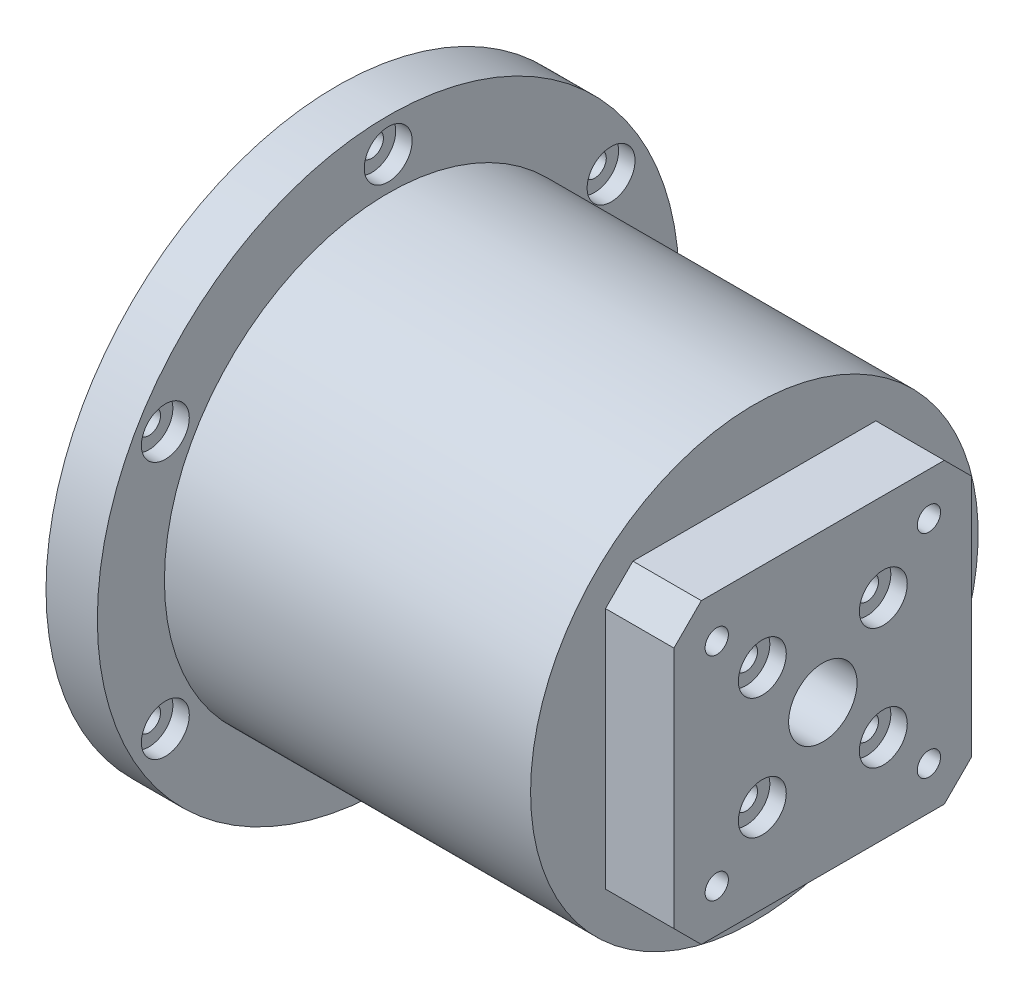
from build123d import *

# Parameters (mm, degrees)
CROQUIS1_R                                           = 5
SALIENTE_EXTRUIR1_DEPTH                              = 10
CROQUIS2_R                                           = 32.7
SALIENTE_EXTRUIR2_DEPTH                              = 53.5
CROQUIS3_R                                           = 21.5
CORTAR_EXTRUIR2_DEPTH                                = 55
REFRENTADO_PARA_TORNILLO_CON_CABEZA_TRON_D           = 3.4
REFRENTADO_PARA_TORNILLO_CON_CABEZA_TRON_CBORE_D     = 7
REFRENTADO_PARA_TORNILLO_CON_CABEZA_TRON_CBORE_DEPTH = 2.4
TALADRO_DE_MARGEN_PARA_M31_D                         = 3.4
TALADRO_DE_MARGEN_PARA_M31_DEPTH                     = 16
TALADRO_DE_MARGEN_PARA_M31_TIP                       = 1.021463052
CORTAR_EXTRUIR3_DEPTH                                = 5
CROQUIS11_R                                          = 42.5
SALIENTE_EXTRUIR3_DEPTH                              = 7.5
TALADRO_DE_MARGEN_PARA_M32_D                         = 3.4
TALADRO_DE_MARGEN_PARA_M32_DEPTH                     = 16
TALADRO_DE_MARGEN_PARA_M32_TIP                       = 1.021463052
REFRENTADO_PARA_TORNILLO_CON_CABEZA_2_D              = 3.4
REFRENTADO_PARA_TORNILLO_CON_CABEZA_2_CBORE_D        = 7
REFRENTADO_PARA_TORNILLO_CON_CABEZA_2_CBORE_DEPTH    = 2.4


with BuildPart() as part:
    # Croquis1 → Saliente-Extruir1 (new body)
    with BuildSketch(Plane(origin=(0, 0, 0), x_dir=(0, 0, -1), z_dir=(1, 0, 0))):
        Polygon((-21.75, -17.75), (-21.75, 17.75), (-17.75, 21.75), (17.75, 21.75), (21.75, 17.75), (21.75, -17.75), (17.75, -21.75), (-17.75, -21.75), align=None)
        Circle(CROQUIS1_R, mode=Mode.SUBTRACT)
    extrude(amount=SALIENTE_EXTRUIR1_DEPTH)

    # Croquis2 → Saliente-Extruir2 (add)
    with BuildSketch(Plane.ZY):
        Circle(CROQUIS2_R)
    extrude(amount=SALIENTE_EXTRUIR2_DEPTH)

    # Croquis3 → Cortar-Extruir2 (cut)
    with BuildSketch(Plane.ZY.offset(53.5)):
        Circle(CROQUIS3_R)
    extrude(amount=-CORTAR_EXTRUIR2_DEPTH, mode=Mode.SUBTRACT)

    # Refrentado para tornillo con cabeza tron (through all)
    with Locations(Plane(origin=(10, 0, 0), x_dir=(0, 0, -1), z_dir=(1, 0, 0))):
        with Locations((-8.838834765, 8.838834765), (8.838834765, 8.838834765), (8.838834765, -8.838834765), (-8.838834765, -8.838834765)):
            CounterBoreHole(REFRENTADO_PARA_TORNILLO_CON_CABEZA_TRON_D / 2, REFRENTADO_PARA_TORNILLO_CON_CABEZA_TRON_CBORE_D / 2, REFRENTADO_PARA_TORNILLO_CON_CABEZA_TRON_CBORE_DEPTH)

    # Taladro de margen para M31
    with Locations(Plane(origin=(10, 0, 0), x_dir=(0, 0, -1), z_dir=(1, 0, 0))):
        with Locations((15.5, 15.5), (15.5, -15.5), (-15.5, -15.5), (-15.5, 15.5)):
            Hole(TALADRO_DE_MARGEN_PARA_M31_D / 2, depth=TALADRO_DE_MARGEN_PARA_M31_DEPTH)
            with Locations((0, 0, -(TALADRO_DE_MARGEN_PARA_M31_DEPTH + TALADRO_DE_MARGEN_PARA_M31_TIP / 2))):  # 118° drill point
                Cone(0, TALADRO_DE_MARGEN_PARA_M31_D / 2, TALADRO_DE_MARGEN_PARA_M31_TIP, mode=Mode.SUBTRACT)

    # Croquis10 → Cortar-Extruir3 (cut)
    with BuildSketch(Plane.ZY.offset(-1.5)):
        Polygon((-13.251400436, 13.251400436), (-12.428355872, 16.323044563), (-14.676955437, 18.571644128), (-17.748599564, 17.748599564), (-18.571644128, 14.676955437), (-16.323044563, 12.428355872), align=None)
        Polygon((18.571644128, 14.676955437), (17.748599564, 17.748599564), (14.676955437, 18.571644128), (12.428355872, 16.323044563), (13.251400436, 13.251400436), (16.323044563, 12.428355872), align=None)
        Polygon((14.676955437, -18.571644128), (17.748599564, -17.748599564), (18.571644128, -14.676955437), (16.323044563, -12.428355872), (13.251400436, -13.251400436), (12.428355872, -16.323044563), align=None)
        Polygon((-18.571644128, -14.676955437), (-17.748599564, -17.748599564), (-14.676955437, -18.571644128), (-12.428355872, -16.323044563), (-13.251400436, -13.251400436), (-16.323044563, -12.428355872), align=None)
    extrude(amount=CORTAR_EXTRUIR3_DEPTH, mode=Mode.SUBTRACT)

    # Croquis11 → Saliente-Extruir3 (add)
    with BuildSketch(Plane.ZY.offset(53.5)):
        Circle(CROQUIS11_R)
        Polygon((-21.5, -17.75), (-21.5, 17.75), (-17.75, 21.5), (17.75, 21.5), (21.5, 17.75), (21.5, -17.75), (17.75, -21.5), (-17.75, -21.5), align=None, mode=Mode.SUBTRACT)
    extrude(amount=SALIENTE_EXTRUIR3_DEPTH)

    # Taladro de margen para M32
    with Locations(Plane.ZY.offset(53.5)):
        with Locations((-17.075, 17.075), (17.075, 17.075), (17.075, -17.075), (-17.075, -17.075)):
            Hole(TALADRO_DE_MARGEN_PARA_M32_D / 2, depth=TALADRO_DE_MARGEN_PARA_M32_DEPTH)
            with Locations((0, 0, -(TALADRO_DE_MARGEN_PARA_M32_DEPTH + TALADRO_DE_MARGEN_PARA_M32_TIP / 2))):  # 118° drill point
                Cone(0, TALADRO_DE_MARGEN_PARA_M32_D / 2, TALADRO_DE_MARGEN_PARA_M32_TIP, mode=Mode.SUBTRACT)

    # Refrentado para tornillo con cabeza  2 (through all)
    with Locations(Plane(origin=(-53.5, 0, 0), x_dir=(0, 0, -1), z_dir=(1, 0, 0))):
        with Locations((0, 37.6), (32.562555182, 18.8), (32.562555182, -18.8), (0, -37.6), (-32.562555182, -18.8), (-32.562555182, 18.8)):
            CounterBoreHole(REFRENTADO_PARA_TORNILLO_CON_CABEZA_2_D / 2, REFRENTADO_PARA_TORNILLO_CON_CABEZA_2_CBORE_D / 2, REFRENTADO_PARA_TORNILLO_CON_CABEZA_2_CBORE_DEPTH)


solid = part.part
